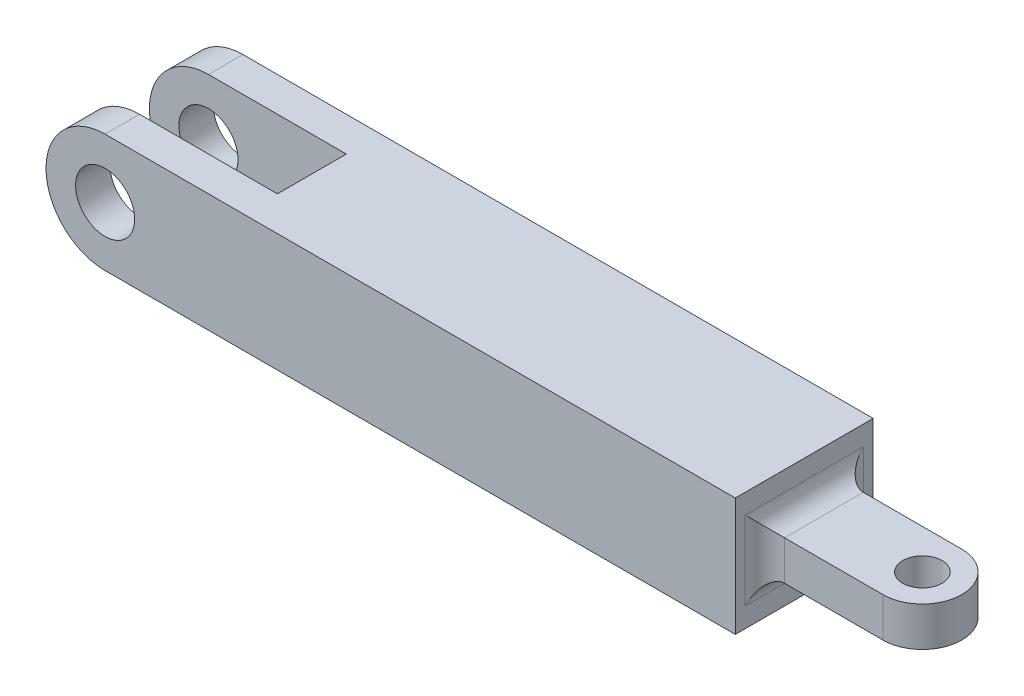
from build123d import *

# Parameters (mm, degrees)
BOSS_EXTRUDE1_DEPTH     = 7
SKETCH2_W               = 8
SKETCH2_H               = 4
BOSS_EXTRUDE2_DEPTH     = 16
FILLET1_RADIUS          = 4
FILLET1_LENGTH          = 4
SKETCH3_R               = 2
CUT_EXTRUDE1_DEPTH      = 16
SKETCH5_W               = 20
SKETCH5_H               = 7
SKETCH5_W_2             = 14
SKETCH5_W_3             = 6
CUT_EXTRUDE2_DEPTH      = 33
CUT_EXTRUDE3_DEPTH      = 73.387844283
CUT_EXTRUDE3_DEPTH_BACK = 73.387844283
SKETCH6_R               = 3
FILLET2_R               = 2


with BuildPart() as part:
    # Sketch1 → Boss-Extrude1 (new, symmetric)
    with BuildSketch(Plane.XY):
        with BuildLine():
            Line((0, 0), (0, 12))
            Line((0, 12), (-64, 12))
            ThreePointArc((-64, 12), (-70, 6), (-64, 0))
            Line((-64, 0), (0, 0))
        make_face()
    extrude(amount=BOSS_EXTRUDE1_DEPTH, both=True)

    # Sketch2 → Boss-Extrude2 (add)
    with BuildSketch(Plane(origin=(0, 0, 0), x_dir=(0, 0, -1), z_dir=(1, 0, 0))):
        with Locations((0, 6)):
            Rectangle(SKETCH2_W, SKETCH2_H)
    extrude(amount=BOSS_EXTRUDE2_DEPTH)

    # Fillet1: full round fillet: the end face becomes a half cylinder, R = half its width
    fillet1_face = Plane((16, 6, 0), x_dir=(0, -1, 0), z_dir=(1, 0, 0))  # on the end face: x along it, z out of the body
    fillet1_slab = fillet1_face.offset(-FILLET1_RADIUS / 2) * Box(FILLET1_LENGTH, 2 * FILLET1_RADIUS, FILLET1_RADIUS, mode=Mode.PRIVATE)  # the body's end, R deep
    fillet1_round = Plane((12, 6, 0), x_dir=(1, 0, 0), z_dir=(0, -1, 0)) * Cylinder(FILLET1_RADIUS, FILLET1_LENGTH, mode=Mode.PRIVATE)  # its axis R under the face
    add(fillet1_slab - fillet1_round, mode=Mode.SUBTRACT)

    # Sketch3 → Cut-Extrude1 (cut)
    with BuildSketch(Plane(origin=(0, 8, 0), x_dir=(1, 0, 0), z_dir=(0, 1, 0))):
        with Locations(Location((12, 0, 0), (0, 0, 270))):
            Circle(SKETCH3_R)
    extrude(amount=-CUT_EXTRUDE1_DEPTH, mode=Mode.SUBTRACT)

    # Sketch5 → Cut-Extrude2 (cut)
    with BuildSketch(Plane(origin=(0, 12, 0), x_dir=(1, 0, 0), z_dir=(0, 1, 0))):
        with Locations((-80, 0)):
            Rectangle(SKETCH5_W, SKETCH5_H)
        with Locations((-57, 0)):
            Rectangle(SKETCH5_W_2, SKETCH5_H)
        with Locations((-67, 0)):
            Rectangle(SKETCH5_W_3, SKETCH5_H)
    extrude(amount=-CUT_EXTRUDE2_DEPTH, mode=Mode.SUBTRACT)

    # Sketch6 → Cut-Extrude3 (cut, two sides: drawn at the far end of the back side and taken through both)
    with BuildSketch(Plane.XY.offset(7).offset(-CUT_EXTRUDE3_DEPTH_BACK)):
        with Locations((-64, 6)):
            Circle(SKETCH6_R)
    extrude(amount=CUT_EXTRUDE3_DEPTH + CUT_EXTRUDE3_DEPTH_BACK, mode=Mode.SUBTRACT)

    # Fillet2
    fillet2_edges = [part.edges().sort_by_distance(p)[0] for p in [
        (0, 4, 0),
        (0, 6, -4),
        (0, 8, 0),
        (0, 6, 4),
    ]]
    fillet(fillet2_edges, radius=FILLET2_R)


solid = part.part
